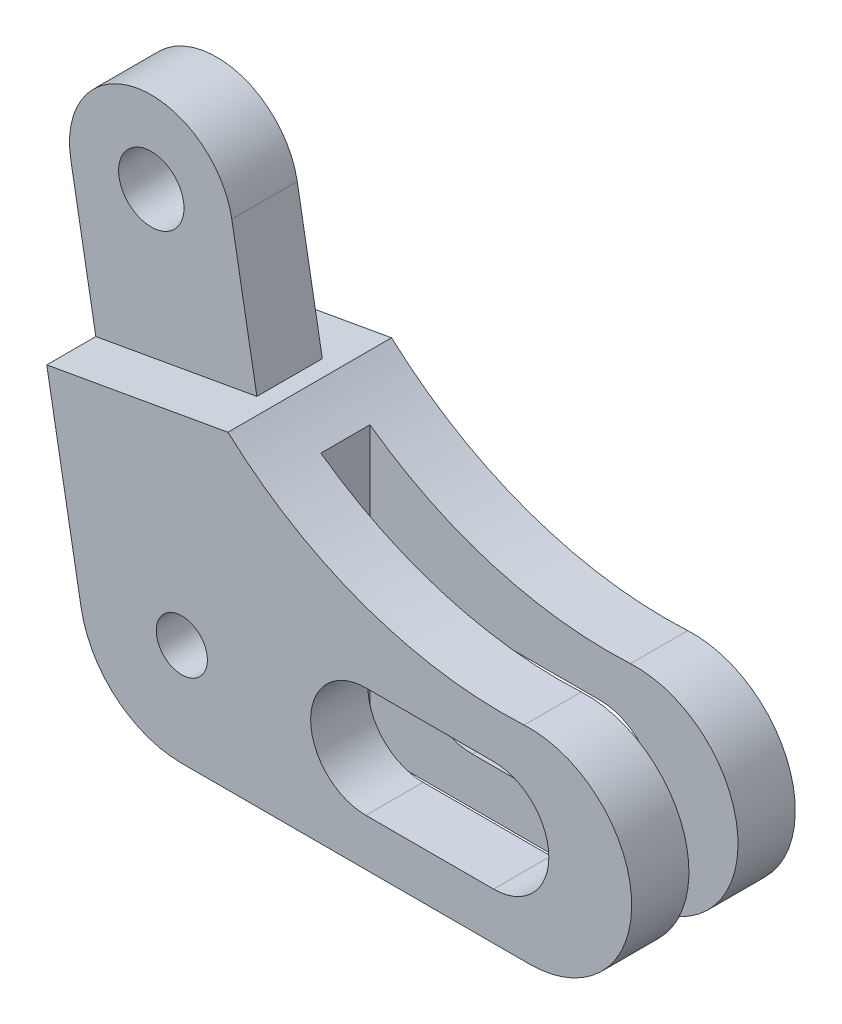
from build123d import *

# Parameters (mm, degrees)
SKETCH1_R                = 6.25
BOSS_EXTRUDE1_DEPTH      = 20
CUT_EXTRUDE2_DEPTH       = 6
BOSS_EXTRUDE2_DEPTH      = 8
BOSS_EXTRUDE2_DEPTH_BACK = 8
SKETCH8_R                = 8
CUT_EXTRUDE3_DEPTH       = 143.929611875


with BuildPart() as part:
    # Sketch1 → Boss-Extrude1 (new, symmetric)
    with BuildSketch(Plane.XY):
        with BuildLine():
            Line((0, -38.979129488), (85, -38.979129488))
            ThreePointArc((85, -38.979129488), (109.991458118, -13.325660942), (83.693509457, 10.986708821))
            ThreePointArc((83.693509457, 10.986708821), (44.909838533, 16.648787206), (11.281411091, 36.782369345))
            Line((11.281411091, 36.782369345), (-33.022622734, 28.898678149))
            Line((-33.022622734, 28.898678149), (-24.613352125, -18.35895793))
            ThreePointArc((-24.613352125, -18.35895793), (-16.054661145, -33.142841433), (0, -38.979129488))
        make_face()
        with Locations((0, -13.979129488)):
            Circle(SKETCH1_R, mode=Mode.SUBTRACT)
        with BuildLine():
            Line((45, -0.479129488), (76.239117398, -0.479129488))
            ThreePointArc((76.239117398, -0.479129488), (89.739117398, -13.979129488), (76.239117398, -27.479129488))
            Line((76.239117398, -27.479129488), (45, -27.479129488))
            ThreePointArc((45, -27.479129488), (31.5, -13.979129488), (45, -0.479129488))
        make_face(mode=Mode.SUBTRACT)
    extrude(amount=BOSS_EXTRUDE1_DEPTH, both=True)

    # Sketch5 → Cut-Extrude2 (cut, symmetric)
    with BuildSketch(Plane.XY):
        with BuildLine():
            Line((20, 29.723334557), (20, -38.979129488))
            Line((20, -38.979129488), (85, -38.979129488))
            ThreePointArc((85, -38.979129488), (109.991458118, -13.325660942), (83.693509457, 10.986708821))
            ThreePointArc((83.693509457, 10.986708821), (50.246422532, 14.914833293), (20, 29.723334557))
        make_face()
    extrude(amount=CUT_EXTRUDE2_DEPTH, both=True, mode=Mode.SUBTRACT)

    # Sketch7 → Boss-Extrude2 (add, two sides: drawn at the far end of the back side and taken through both)
    with BuildSketch(Plane.XY.offset(-BOSS_EXTRUDE2_DEPTH_BACK)):
        with BuildLine():
            Line((-33.022622734, 28.898678149), (6.358740666, 35.906403657))
            Line((6.358740666, 35.906403657), (0.226980847, 70.365096632))
            ThreePointArc((0.226980847, 70.365096632), (0.458819494, 68.619978601), (0.536299147, 66.861233878))
            ThreePointArc((0.536299147, 66.861233878), (-17.70495613, 46.93871353), (-39.154382553, 63.357371124))
            Line((-39.154382553, 63.357371124), (-33.022622734, 28.898678149))
        make_face()
        with BuildLine():
            ThreePointArc((0.536299147, 66.861233878), (0.458819494, 68.619978601), (0.226980847, 70.365096632))
            Line((0.226980847, 70.365096632), (-39.154382553, 63.357371124))
            ThreePointArc((-39.154382553, 63.357371124), (-17.70495613, 46.93871353), (0.536299147, 66.861233878))
        make_face()
        with BuildLine():
            Line((-39.154382553, 63.357371124), (0.226980847, 70.365096632))
            ThreePointArc((0.226980847, 70.365096632), (-22.967563607, 86.551915578), (-39.154382553, 63.357371124))
        make_face()
    extrude(amount=BOSS_EXTRUDE2_DEPTH + BOSS_EXTRUDE2_DEPTH_BACK)

    # Sketch8 → Cut-Extrude3 (cut, through all)
    with BuildSketch(Plane.XY.offset(8)):
        with Locations((-19.463700853, 66.861233878)):
            Circle(SKETCH8_R)
    extrude(amount=-CUT_EXTRUDE3_DEPTH, mode=Mode.SUBTRACT)


solid = part.part
